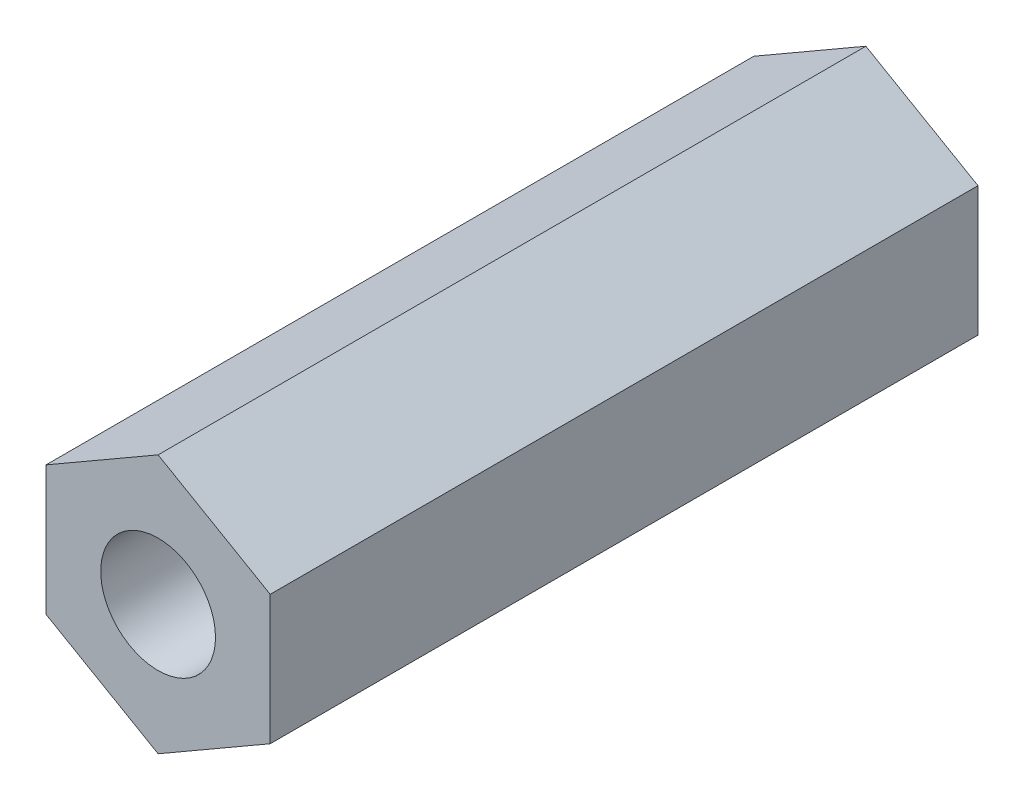
from build123d import *

# Parameters (mm, degrees)
ESQUISSE1_R        = 1.5
BOSS_EXTRU_1_DEPTH = 18.5


with BuildPart() as part:
    # Esquisse1 → Boss.-Extru.1 (new body)
    with BuildSketch(Plane.XY):
        Polygon((0, -3.383272577), (2.93, -1.691636289), (2.93, 1.691636289), (0, 3.383272577), (-2.93, 1.691636289), (-2.93, -1.691636289), align=None)
        Circle(ESQUISSE1_R, mode=Mode.SUBTRACT)
    extrude(amount=BOSS_EXTRU_1_DEPTH)


solid = part.part
